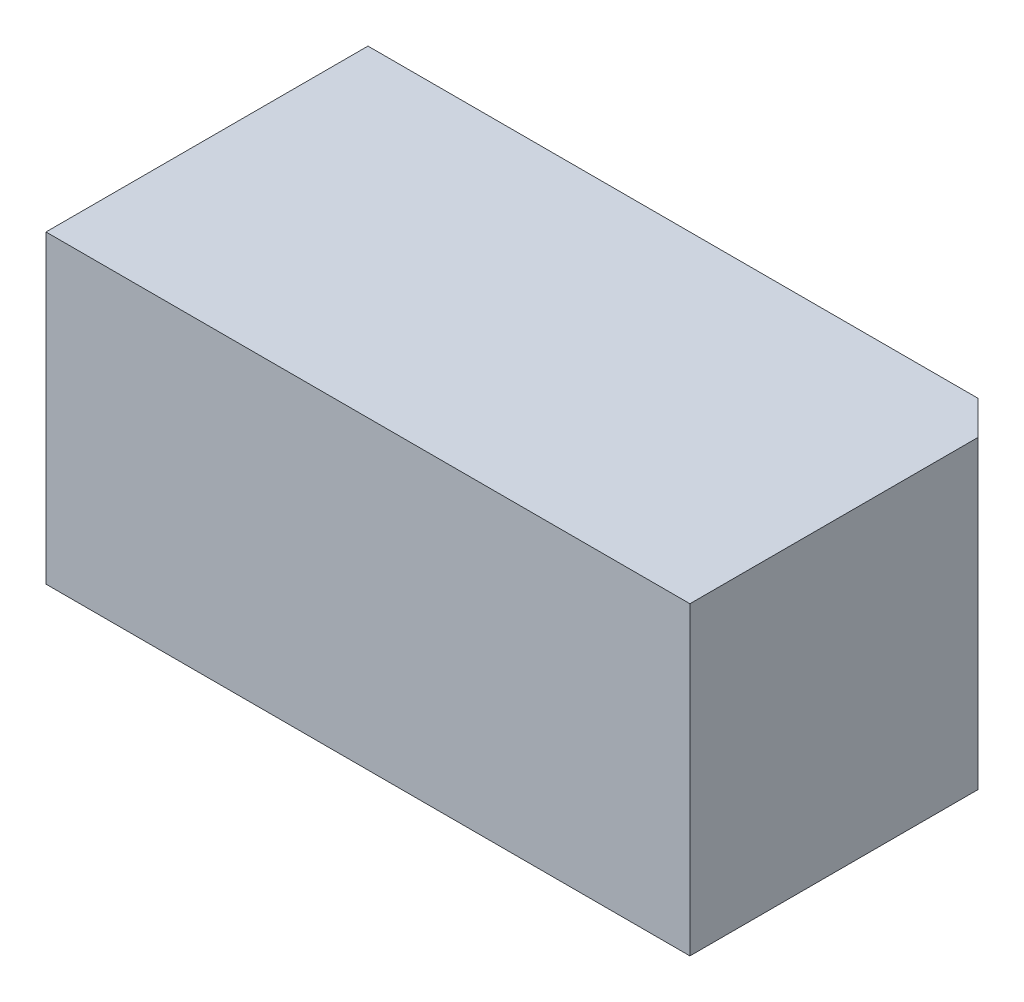
from build123d import *

# Parameters (mm, degrees)
EXTRUDE_1_DEPTH = 18
SKETCH_2_R      = 0.4
EXTRUDE_2_DEPTH = 2


with BuildPart() as part:
    # Эскиз1 → Бобышка-Вытянуть1 (new body)
    with BuildSketch(Plane(origin=(0, 0, 0), x_dir=(1, 0, 0), z_dir=(0, 1, 0))):
        Polygon((19, -9.5), (19, 7.5), (17, 9.5), (-19, 9.5), (-19, -9.5), align=None)
    extrude(amount=EXTRUDE_1_DEPTH)

    # Эскиз2 → Бобышка-Вытянуть2 (add)
    with BuildSketch(Plane.XZ):
        with Locations(Location((-15.75, 5.35, 0), (0, 0, 270))):
            Circle(SKETCH_2_R)
        with Locations(Location((-15.75, -5.35, 0), (0, 0, 270))):
            Circle(SKETCH_2_R)
        with Locations(Location((15.75, 4.05, 0), (0, 0, 270))):
            Circle(SKETCH_2_R)
        with Locations(Location((15.75, -4.05, 0), (0, 0, 270))):
            Circle(SKETCH_2_R)
    extrude(amount=EXTRUDE_2_DEPTH)


solid = part.part
